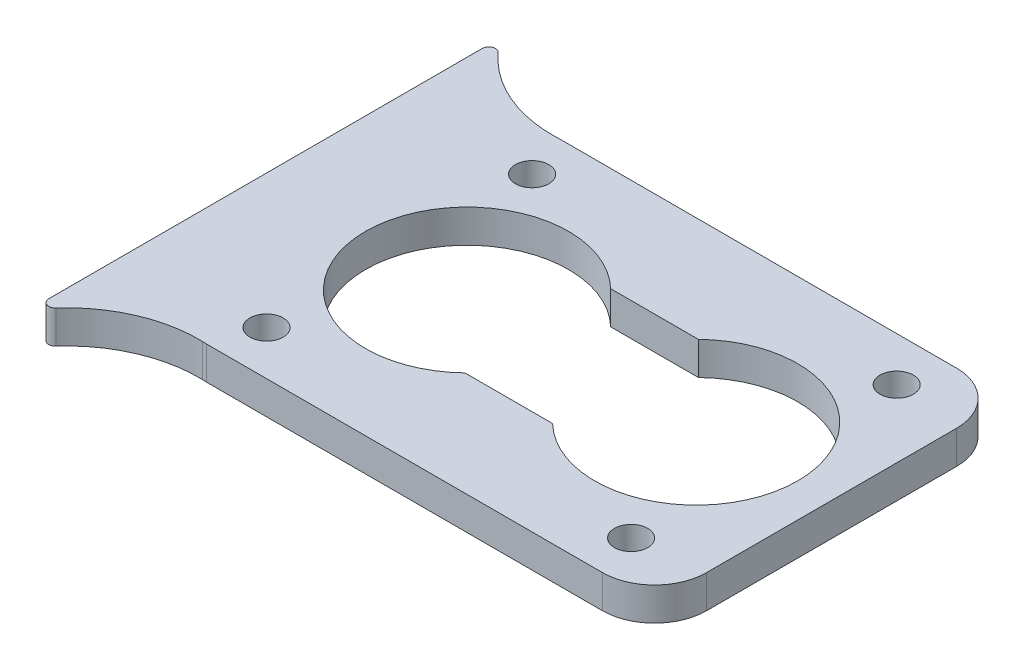
from build123d import *

# Parameters (mm, degrees)
BOSS_EXTRUDE1_DEPTH = 3.175
BOSS_EXTRUDE2_DEPTH = 3.175
FILLET1_R           = 0.635


with BuildPart() as part:
    # Sketch1 → Boss-Extrude1 (new body)
    with BuildSketch(Plane(origin=(0, 0, 0), x_dir=(1, 0, 0), z_dir=(0, 1, 0))):
        with BuildLine():
            Line((-157.73462252, 34.703486642), (-119.73462252, 34.703486642))
            ThreePointArc((-119.73462252, 34.703486642), (-116.199088614, 36.167952736), (-114.73462252, 39.703486642))
            Line((-114.73462252, 39.703486642), (-114.73462252, 63.703486642))
            ThreePointArc((-114.73462252, 63.703486642), (-116.199088614, 67.239020548), (-119.73462252, 68.703486642))
            Line((-119.73462252, 68.703486642), (-157.73462252, 68.703486642))
            ThreePointArc((-157.73462252, 68.703486642), (-161.270156426, 67.239020548), (-162.73462252, 63.703486642))
            Line((-162.73462252, 63.703486642), (-162.73462252, 39.703486642))
            ThreePointArc((-162.73462252, 39.703486642), (-161.270156426, 36.167952736), (-157.73462252, 34.703486642))
        make_face()
        with BuildLine():
            Line((-134.5215585, 44.703486642), (-142.94768654, 44.703486642))
            ThreePointArc((-142.94768654, 44.703486642), (-146.073167891, 42.667101856), (-149.73462252, 41.953486642))
            ThreePointArc((-149.73462252, 41.953486642), (-159.48462252, 51.703486642), (-149.73462252, 61.453486642))
            ThreePointArc((-149.73462252, 61.453486642), (-146.073167891, 60.739871428), (-142.94768654, 58.703486642))
            Line((-142.94768654, 58.703486642), (-134.5215585, 58.703486642))
            ThreePointArc((-134.5215585, 58.703486642), (-131.396077149, 60.739871428), (-127.73462252, 61.453486642))
            ThreePointArc((-127.73462252, 61.453486642), (-117.98462252, 51.703486642), (-127.73462252, 41.953486642))
            ThreePointArc((-127.73462252, 41.953486642), (-131.396077149, 42.667101856), (-134.5215585, 44.703486642))
        make_face(mode=Mode.SUBTRACT)
        with BuildLine():
            ThreePointArc((-121.23462252, 37.353486642), (-119.63462252, 38.953486642), (-121.23462252, 40.553486642))
            ThreePointArc((-121.23462252, 40.553486642), (-122.83462252, 38.953486642), (-121.23462252, 37.353486642))
        make_face(mode=Mode.SUBTRACT)
        with BuildLine():
            ThreePointArc((-156.23462252, 37.353486642), (-154.63462252, 38.953486642), (-156.23462252, 40.553486642))
            ThreePointArc((-156.23462252, 40.553486642), (-157.83462252, 38.953486642), (-156.23462252, 37.353486642))
        make_face(mode=Mode.SUBTRACT)
        with BuildLine():
            ThreePointArc((-156.23462252, 62.853486642), (-154.63462252, 64.453486642), (-156.23462252, 66.053486642))
            ThreePointArc((-156.23462252, 66.053486642), (-157.83462252, 64.453486642), (-156.23462252, 62.853486642))
        make_face(mode=Mode.SUBTRACT)
        with BuildLine():
            ThreePointArc((-121.23462252, 62.853486642), (-119.63462252, 64.453486642), (-121.23462252, 66.053486642))
            ThreePointArc((-121.23462252, 66.053486642), (-122.83462252, 64.453486642), (-121.23462252, 62.853486642))
        make_face(mode=Mode.SUBTRACT)
    extrude(amount=BOSS_EXTRUDE1_DEPTH)

    # Sketch2 → Boss-Extrude2 (add)
    with BuildSketch(Plane.XZ):
        with BuildLine():
            Line((-169.08462252, -29.024879137), (-169.08462252, -74.382094147))
            ThreePointArc((-169.08462252, -74.382094147), (-164.359232711, -70.120144783), (-158.159635896, -68.685390257))
            ThreePointArc((-158.159635896, -68.685390257), (-161.417357026, -67.085419013), (-162.73462252, -63.703486642))
            Line((-162.73462252, -63.703486642), (-162.73462252, -39.703486642))
            ThreePointArc((-162.73462252, -39.703486642), (-161.417357026, -36.321554271), (-158.159635896, -34.721583027))
            ThreePointArc((-158.159635896, -34.721583027), (-164.359232711, -33.286828501), (-169.08462252, -29.024879137))
        make_face()
    extrude(amount=-BOSS_EXTRUDE2_DEPTH)

    # Fillet1
    fillet1_edges = [part.edges().sort_by_distance(p)[0] for p in [
        (-169.08462252, 1.5875, -74.382094147),
        (-169.08462252, 1.5875, -29.024879137),
    ]]
    fillet(fillet1_edges, radius=FILLET1_R)


solid = part.part
